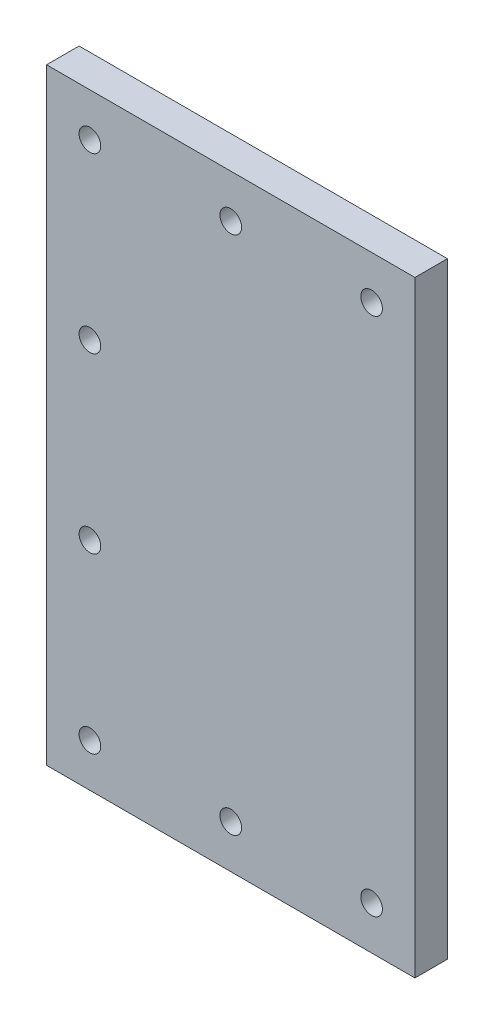
from build123d import *

# Parameters (mm, degrees)
SKETCH1_W            = 85
SKETCH1_H            = 140
BOSS_EXTRUDE1_DEPTH  = 3.75
SKETCH2_R            = 2.5
CUT_EXTRUDE1_DEPTH   = 83.234421017
LPATTERN1_COUNT      = 3
LPATTERN1_PITCH      = 32.5
LPATTERN1_COUNT_DIR2 = 4
LPATTERN1_PITCH_DIR2 = 40


with BuildPart() as part:
    # Sketch1 → Boss-Extrude1 (new, symmetric)
    with BuildSketch(Plane.XY):
        Rectangle(SKETCH1_W, SKETCH1_H)
    extrude(amount=BOSS_EXTRUDE1_DEPTH, both=True)

    # Sketch2 → Cut-Extrude1 (cut, symmetric)
    with BuildSketch(Plane.XY.offset(3.75)):
        with Locations((-32.5, 60)):
            Circle(SKETCH2_R)
    cut_extrude1 = extrude(amount=CUT_EXTRUDE1_DEPTH, both=True, mode=Mode.SUBTRACT)

    # LPattern1: Cut-Extrude1 3 × 4, 4 skipped
    with Locations(*[(i * LPATTERN1_PITCH, -j * LPATTERN1_PITCH_DIR2, 0) for i in range(LPATTERN1_COUNT) for j in range(LPATTERN1_COUNT_DIR2) if (i, j) not in ((0, 0), (1, 1), (1, 2), (2, 1), (2, 2))]):
        add(cut_extrude1, mode=Mode.SUBTRACT)


solid = part.part
